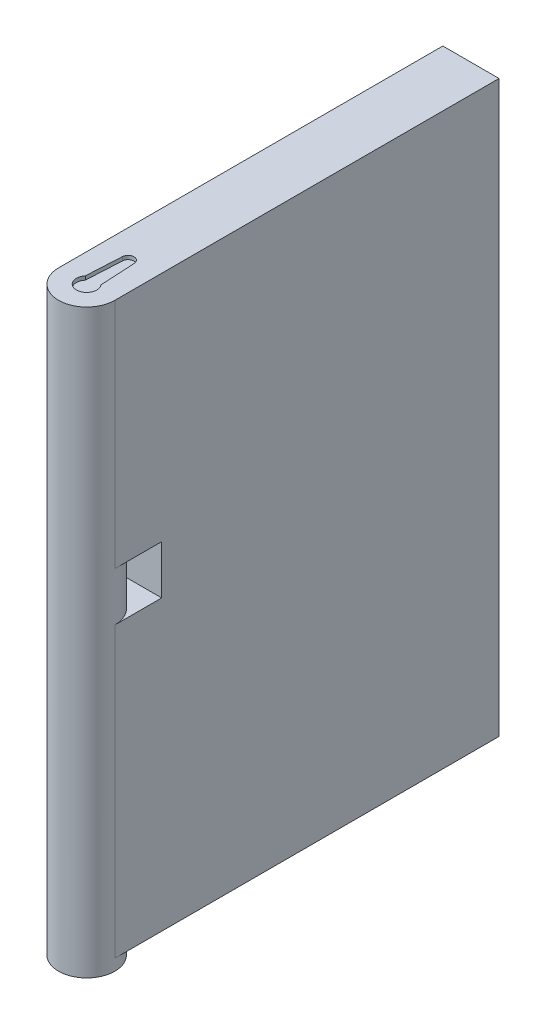
from build123d import *
from build123d.topology import SkipClean

# Parameters (mm, degrees)
BOSS_EXTRUDE1_DEPTH = 96.52
SKETCH2_R           = 9.525
BOSS_EXTRUDE2_DEPTH = 3.81
CUT_EXTRUDE1_DEPTH  = 1.27
CUT_EXTRUDE2_START  = -114.3
CUT_EXTRUDE2_DEPTH  = 16.51


with BuildPart() as part:
    # Sketch1 → Boss-Extrude1 (new, symmetric)
    with BuildSketch(Plane(origin=(0, 0, 0), x_dir=(1, 0, 0), z_dir=(0, 1, 0))):
        with BuildLine():
            ThreePointArc((-9.525, -60.325), (-6.735192091, -67.060192091), (0, -69.85))
            ThreePointArc((0, -69.85), (6.735192091, -67.060192091), (9.525, -60.325))
            Line((9.525, -60.325), (9.525, 69.85))
            Line((9.525, 69.85), (-9.525, 69.85))
            Line((-9.525, 69.85), (-9.525, -60.325))
        make_face()
    extrude(amount=BOSS_EXTRUDE1_DEPTH, both=True)

    # Sketch2 → Boss-Extrude2 (add)
    with SkipClean():  # the faces are left unmerged after this step: merging them gives an invalid solid
        with BuildSketch(Plane.XZ.offset(96.52)):
            with Locations(Location((0, 60.325, 0), (0, 0, 270))):
                Circle(SKETCH2_R)
        extrude(amount=BOSS_EXTRUDE2_DEPTH)

    # Sketch3 → Cut-Extrude1 (cut)
    with SkipClean():  # the faces are left unmerged after this step: merging them gives an invalid solid
        with BuildSketch(Plane(origin=(0, 96.52, 0), x_dir=(1, 0, 0), z_dir=(0, 1, 0))):
            with BuildLine():
                Line((-2.653910055, -58.137819903), (-2.000444386, -46.187796735))
                ThreePointArc((-2.000444386, -46.187796735), (-0.003346519, -44.297000013), (1.993597371, -46.187959354))
                Line((1.993597371, -46.187959354), (2.646089941, -58.138035694))
                ThreePointArc((2.646089941, -58.138035694), (-0.004140468, -63.796999997), (-2.653910055, -58.137819903))
            make_face()
        extrude(amount=-CUT_EXTRUDE1_DEPTH, mode=Mode.SUBTRACT)

    # Sketch5 → Cut-Extrude2 (cut)
    with SkipClean():  # the faces are left unmerged after this step: merging them gives an invalid solid
        with BuildSketch(Plane.XZ.offset(96.52).offset(CUT_EXTRUDE2_START)):
            with BuildLine():
                Line((9.525, 44.45), (-9.525, 44.45))
                Line((-9.525, 44.45), (-9.525, 60.325))
                ThreePointArc((-9.525, 60.325), (0, 50.8), (9.525, 60.325))
                Line((9.525, 60.325), (9.525, 44.45))
            make_face()
        extrude(amount=CUT_EXTRUDE2_DEPTH, mode=Mode.SUBTRACT)


solid = part.part
